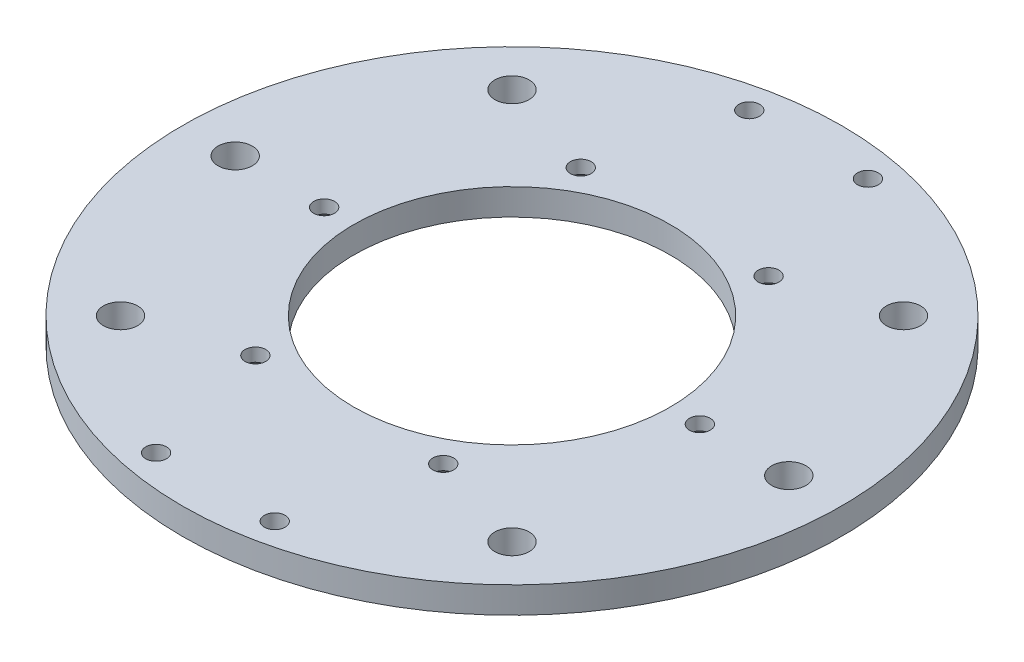
from build123d import *

# Parameters (mm, degrees)
SKETCH_1_R                  = 50
SKETCH_1_R_2                = 24
EXTRUDE_1_DEPTH             = 4
PATTERN_CIRCULAR_1_COUNT    = 6
CHAMFER_1_SIZE              = 2
HOLE_WIZARD_M32_D           = 3.15
PATTERN_LINEAR_1_COUNT      = 2
PATTERN_LINEAR_1_PITCH      = 18
PATTERN_LINEAR_1_COUNT_DIR2 = 2
PATTERN_LINEAR_1_PITCH_DIR2 = 90
HOLE_WIZARD_M52_D           = 5.2
PATTERN_CIRCULAR_3_COUNT    = 2
PATTERN_CIRCULAR_3_ANGLE    = 45
F_3_THE_OTHER_WAY_COUNT     = 2
F_3_THE_OTHER_WAY_ANGLE     = 45


with BuildPart() as part:
    # Эскиз1 → Бобышка-Вытянуть1 (new body)
    with BuildSketch(Plane(origin=(0, 0, 0), x_dir=(1, 0, 0), z_dir=(0, 1, 0))):
        with Locations(Location((0, 0, 0), (0, 0, 270))):
            Circle(SKETCH_1_R)
        with Locations(Location((0, 0, 0), (0, 0, 270))):
            Circle(SKETCH_1_R_2, mode=Mode.SUBTRACT)
    extrude(amount=EXTRUDE_1_DEPTH)

    # Эскиз3 → Сверло под метчик  спиральное M31 (revolve, cut)
    with BuildSketch(Plane(origin=(28.5, 4, 0), x_dir=(0, 0, 1), z_dir=(1, 0, 0))):
        Polygon((0, 0), (0, 8.946355475), (1.575, 8), (1.575, 0), align=None)
    hole_wizard_m31 = revolve(axis=Axis((28.5, 10.35, 0), (0, -1, 0)), mode=Mode.SUBTRACT)

    # Круговой массив1: Сверло под метчик  спиральное M31 ×6 about axis
    pattern_circular_1_axis = Axis((0, 0, 0), (0, 1, 0))
    for i in range(1, PATTERN_CIRCULAR_1_COUNT):
        add(hole_wizard_m31.rotate(pattern_circular_1_axis, i * 360 / PATTERN_CIRCULAR_1_COUNT), mode=Mode.SUBTRACT)

    # Фаска1
    chamfer_1_edges = [part.edges().sort_by_distance(p)[0] for p in [
        (28.5, 0, -1.575),
        (12.886009989, 0, -25.469224008),
        (-15.613990011, 0, -23.894224008),
        (-28.5, 0, 1.575),
        (-12.886009989, 0, 25.469224008),
        (15.613990011, 0, 23.894224008),
    ]]
    chamfer(chamfer_1_edges, length=CHAMFER_1_SIZE)

    # Сверло под метчик  спиральное M32 (through all)
    with Locations(Plane(origin=(0, 0, 0), x_dir=(-1, 0, 0), z_dir=(0, -1, 0))):
        with Locations((-9, -45)):
            hole_wizard_m32 = Hole(HOLE_WIZARD_M32_D / 2)

    # Линейный массив1: Hole Wizard M32 2 × 2
    with Locations(*[(-i * PATTERN_LINEAR_1_PITCH, 0, -j * PATTERN_LINEAR_1_PITCH_DIR2) for i in range(PATTERN_LINEAR_1_COUNT) for j in range(PATTERN_LINEAR_1_COUNT_DIR2) if (i, j) != (0, 0)]):
        add(hole_wizard_m32, mode=Mode.SUBTRACT)

    # Сверло под метчик  спиральное M52 (through all)
    with Locations(Plane(origin=(0, 0, 0), x_dir=(-1, 0, 0), z_dir=(0, -1, 0))):
        with Locations((42, 0), (-42, 0)):
            hole_wizard_m52 = Hole(HOLE_WIZARD_M52_D / 2)

    # Круговой массив3: Сверло под метчик  спиральное M52 ×2 about axis
    pattern_circular_3_axis = Axis((0, 0, 0), (0, 1, 0))
    for i in range(1, PATTERN_CIRCULAR_3_COUNT):
        add(hole_wizard_m52.rotate(pattern_circular_3_axis, i * PATTERN_CIRCULAR_3_ANGLE / (PATTERN_CIRCULAR_3_COUNT - 1)), mode=Mode.SUBTRACT)

    # 3 the other way: Сверло под метчик  спиральное M52 ×2 about axis
    f_3_the_other_way_axis = Axis((0, 0, 0), (0, -1, 0))
    for i in range(1, F_3_THE_OTHER_WAY_COUNT):
        add(hole_wizard_m52.rotate(f_3_the_other_way_axis, i * F_3_THE_OTHER_WAY_ANGLE / (F_3_THE_OTHER_WAY_COUNT - 1)), mode=Mode.SUBTRACT)


solid = part.part
